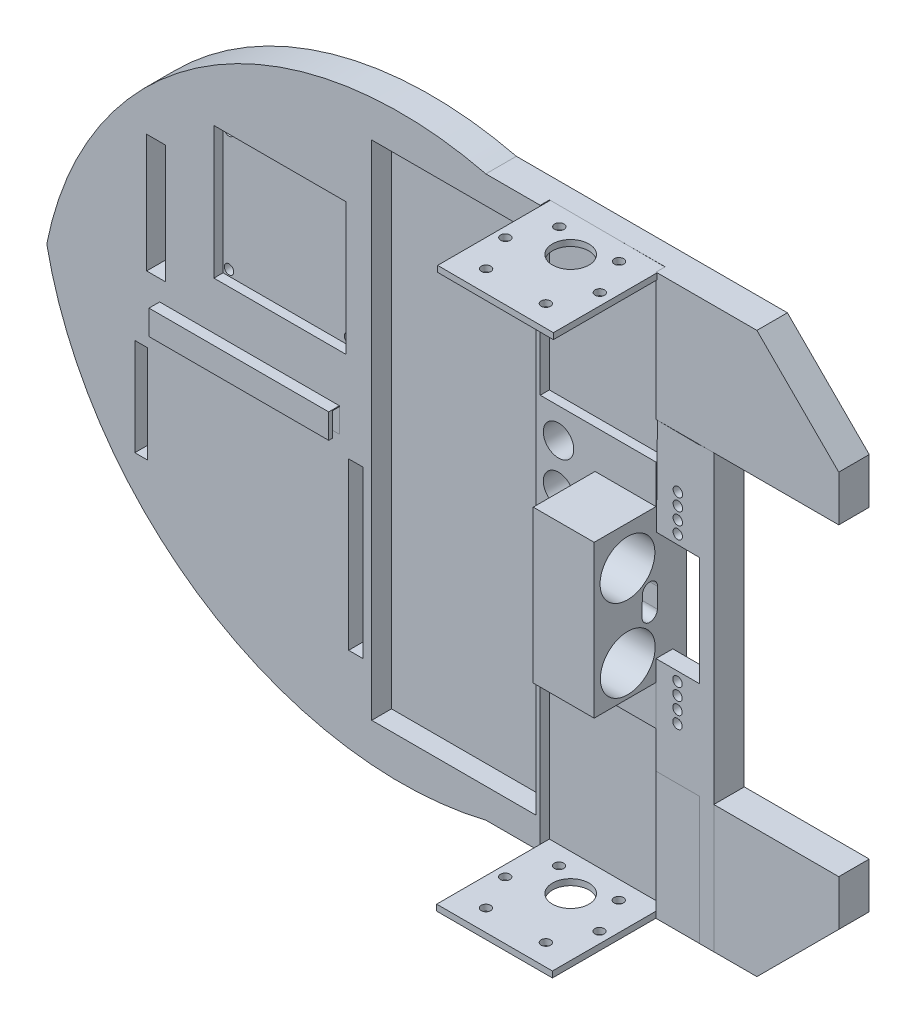
from build123d import *

# Parameters (mm, degrees)
BOSS_EXTRUDE1_DEPTH      = 10
BOSS_EXTRUDE1_DEPTH_BACK = 0.01
SKETCH3_W                = 38
SKETCH3_H                = 54
CUT_EXTRUDE1_DEPTH       = 3
SKETCH5_W                = 38
SKETCH5_H                = 54
CUT_EXTRUDE3_DEPTH       = 3
SKETCH7_W                = 54
SKETCH7_H                = 165
CUT_EXTRUDE4_DEPTH       = 6.5
SKETCH15_W               = 20
SKETCH15_H               = 50
BOSS_EXTRUDE3_DEPTH      = 20.3
SKETCH18_W               = 43.4
SKETCH18_H               = 43.4
CUT_EXTRUDE18_DEPTH      = 3
SKETCH21_R               = 9
CUT_EXTRUDE21_DEPTH      = 20
SKETCH22_R               = 1.55
CUT_EXTRUDE23_DEPTH      = 223.739666272
SKETCH25_W               = 59
SKETCH25_H               = 8.1
BOSS_EXTRUDE5_DEPTH      = 3.5
SKETCH28_W               = 4.75290021
SKETCH28_H               = 9.947843747
BOSS_EXTRUDE6_DEPTH      = 141.870057685
SKETCH36_W               = 38
SKETCH36_H               = 2
BOSS_EXTRUDE7_DEPTH      = 37
SKETCH39_R               = 6
SKETCH39_R_2             = 1.55
CUT_EXTRUDE28_DEPTH      = 2
SKETCH42_R               = 6
SKETCH42_R_2             = 1.55
CUT_EXTRUDE29_DEPTH      = 2
SKETCH44_W               = 2.25
SKETCH44_H               = 7.82
CUT_EXTRUDE30_DEPTH      = 59
BOSS_EXTRUDE8_REACH      = 227.847
SKETCH45_W               = 16.5
SKETCH45_H               = 32
SKETCH30_W               = 14.12
SKETCH30_H               = 25
CUT_EXTRUDE25_DEPTH      = 4.5
SKETCH33_R               = 1.55
CUT_EXTRUDE26_DEPTH      = 10.017641697
SKETCH46_R               = 5
CUT_EXTRUDE31_DEPTH      = 225.11173314
SKETCH47_W               = 6.139074003
SKETCH47_H               = 38.880802014
SKETCH47_W_2             = 4.706623401
SKETCH47_H_2             = 54.433122819
SKETCH47_W_3             = 4.092716002
SKETCH47_H_3             = 31.923184811
CUT_EXTRUDE32_DEPTH      = 225.11173314


with BuildPart() as part:
    # Sketch1 → Boss-Extrude1 (new, two sides: drawn at the far end of the back side and taken through both)
    with BuildSketch(Plane.XY.offset(-BOSS_EXTRUDE1_DEPTH_BACK)):
        with BuildLine():
            Line((0, 0), (0, -50))
            Line((0, -50), (60, -50))
            Line((60, -50), (60, -65))
            Line((60, -65), (33.129942315, -91.870057685))
            Line((33.129942315, -91.870057685), (-55.850057685, -91.870057685))
            ThreePointArc((-55.850057685, -91.870057685), (-147.4724214, -76.71648961), (-199.999956277, -0.132246858))
            ThreePointArc((-199.999956277, -0.132246858), (-147.567879237, 76.64550452), (-55.850057685, 91.870057685))
            Line((-55.850057685, 91.870057685), (33.129942315, 91.870057685))
            Line((33.129942315, 91.870057685), (60, 65))
            Line((60, 65), (60, 50))
            Line((60, 50), (0, 50))
            Line((0, 50), (0, 0))
        make_face()
    extrude(amount=BOSS_EXTRUDE1_DEPTH + BOSS_EXTRUDE1_DEPTH_BACK)

    # Sketch3 → Cut-Extrude1 (cut)
    with BuildSketch(Plane.XY.offset(10)):
        with Locations((-19, 64.870057685)):
            Rectangle(SKETCH3_W, SKETCH3_H)
    extrude(amount=-CUT_EXTRUDE1_DEPTH, mode=Mode.SUBTRACT)

    # Sketch5 → Cut-Extrude3 (cut)
    with BuildSketch(Plane.XY.offset(10)):
        with Locations((-19, -64.870057685)):
            Rectangle(SKETCH5_W, SKETCH5_H)
    extrude(amount=-CUT_EXTRUDE3_DEPTH, mode=Mode.SUBTRACT)

    # Sketch7 → Cut-Extrude4 (cut)
    with BuildSketch(Plane.XY.offset(10)):
        with Locations((-66.32515636, 0.28573122)):
            Rectangle(SKETCH7_W, SKETCH7_H)
    extrude(amount=-CUT_EXTRUDE4_DEPTH, mode=Mode.SUBTRACT)

    # Sketch15 → Boss-Extrude3 (add)
    with BuildSketch(Plane.XY.offset(10)):
        with Locations((-10, 0.20156489)):
            Rectangle(SKETCH15_W, SKETCH15_H)
    extrude(amount=BOSS_EXTRUDE3_DEPTH)

    # Sketch18 → Cut-Extrude18 (cut)
    with BuildSketch(Plane.XY.offset(10)):
        with Locations((-123.42454895, 39.3)):
            Rectangle(SKETCH18_W, SKETCH18_H)
    extrude(amount=-CUT_EXTRUDE18_DEPTH, mode=Mode.SUBTRACT)

    # Sketch21 → Cut-Extrude21 (cut)
    with BuildSketch(Plane(origin=(0, 0, 0), x_dir=(0, 0, -1), z_dir=(1, 0, 0))):
        with Locations((-19.36187505, 12.37175029)):
            Circle(SKETCH21_R)
        with Locations((-19.26539558, -14.62824971)):
            Circle(SKETCH21_R)
        with BuildLine():
            Line((-9.491579533, 2.276446619), (-9.557448357, -4.178698144))
            ThreePointArc((-9.557448357, -4.178698144), (-12.081396215, -6.651657156), (-14.554355227, -4.127709299))
            Line((-14.554355227, -4.127709299), (-14.488486403, 2.327435464))
            ThreePointArc((-14.488486403, 2.327435464), (-11.964538545, 4.800394476), (-9.491579533, 2.276446619))
        make_face()
    extrude(amount=-CUT_EXTRUDE21_DEPTH, mode=Mode.SUBTRACT)

    # Sketch22 → Cut-Extrude23 (cut, through all)
    with BuildSketch(Plane.XY.offset(7)):
        with Locations((-143.16862044, 58.97947337)):
            Circle(SKETCH22_R)
        with Locations((-103.76862044, 58.97947337)):
            Circle(SKETCH22_R)
        with Locations((-103.76862044, 19.57947337)):
            Circle(SKETCH22_R)
        with Locations((-143.16862044, 19.57947337)):
            Circle(SKETCH22_R)
    extrude(amount=-CUT_EXTRUDE23_DEPTH, mode=Mode.SUBTRACT)

    # Sketch25 → Boss-Extrude5 (add)
    with BuildSketch(Plane.XY.offset(10)):
        with Locations((-133.432578579, -2.134090808)):
            Rectangle(SKETCH25_W, SKETCH25_H)
    extrude(amount=BOSS_EXTRUDE5_DEPTH)

    # Sketch28 → Boss-Extrude6 (add)
    with BuildSketch(Plane.XZ.offset(91.870057685)):
        with Locations((16.603067585, 5.033719824)):
            Rectangle(SKETCH28_W, SKETCH28_H)
    extrude(amount=-BOSS_EXTRUDE6_DEPTH)

    # Sketch36 → Boss-Extrude7 (add)
    with BuildSketch(Plane.XY.offset(7)):
        Polygon((0.325623195, 91.814547745), (0.318530176, 89.814560323), (-37.681230846, 89.949327676), (-37.674137828, 91.949315098), align=None)
        with Locations((-19, -90.81512516)):
            Rectangle(SKETCH36_W, SKETCH36_H)
    extrude(amount=BOSS_EXTRUDE7_DEPTH)

    # Sketch39 → Cut-Extrude28 (cut)
    with BuildSketch(Plane.XZ.offset(91.81512516)):
        with Locations(Location((-19, 19, 0), (0, 0, 270))):
            Circle(SKETCH39_R)
        with Locations(Location((-34.499611559, 25.01055106, 0), (0, 0, 270))):
            Circle(SKETCH39_R_2)
        with Locations(Location((-3.563871147, 24.988758691, 0), (0, 0, 270))):
            Circle(SKETCH39_R_2)
        with Locations(Location((-28.819186805, 37.01055106, 0), (0, 0, 270))):
            Circle(SKETCH39_R_2)
        with Locations(Location((-9.177448314, 36.988758691, 0), (0, 0, 270))):
            Circle(SKETCH39_R_2)
        with Locations(Location((-28.819994175, 13.01055106, 0), (0, 0, 270))):
            Circle(SKETCH39_R_2)
        with Locations(Location((-9.230494356, 12.988758691, 0), (0, 0, 270))):
            Circle(SKETCH39_R_2)
    extrude(amount=-CUT_EXTRUDE28_DEPTH, mode=Mode.SUBTRACT)

    # Sketch42 → Cut-Extrude29 (cut)
    with BuildSketch(Plane(origin=(0.325623195, 91.814547745, 0), x_dir=(0.9999937111161443, -0.003546509292438372, 0), z_dir=(0.003546509292438372, 0.9999937111161443, 0))):
        with Locations(Location((-19.325818013, -19, 0), (0, 0, 180))):
            Circle(SKETCH42_R)
        with Locations(Location((-29.070149337, -13, 0), (0, 0, 180))):
            Circle(SKETCH42_R_2)
        with Locations(Location((-3.778432466, -25, 0), (0, 0, 180))):
            Circle(SKETCH42_R_2)
        with Locations(Location((-9.464104196, -13, 0), (0, 0, 180))):
            Circle(SKETCH42_R_2)
        with Locations(Location((-34.772326096, -25, 0), (0, 0, 180))):
            Circle(SKETCH42_R_2)
        with Locations(Location((-29.096493177, -37, 0), (0, 0, 180))):
            Circle(SKETCH42_R_2)
        with Locations(Location((-9.473371075, -37, 0), (0, 0, 180))):
            Circle(SKETCH42_R_2)
    extrude(amount=-CUT_EXTRUDE29_DEPTH, mode=Mode.SUBTRACT)

    # Sketch44 → Cut-Extrude30 (cut)
    with BuildSketch(Plane.ZY.offset(162.932578579)):
        with Locations((11.13716849, -2.28119145)):
            Rectangle(SKETCH44_W, SKETCH44_H)
    extrude(amount=-CUT_EXTRUDE30_DEPTH, mode=Mode.SUBTRACT)

    # Boss-Extrude8: up to this face of the body (flat: up to its plane)
    boss_extrude8_end = Plane(part.part.faces().sort_by_distance((16.603067585, -20.935028843, 10.007641697))[0])
    # Sketch45 → Boss-Extrude8 (add, up to the picked face)
    with BuildSketch(Plane(origin=(0, 0, -0.01), x_dir=(-1, 0, 0), z_dir=(0, 0, -1)), mode=Mode.PRIVATE) as boss_extrude8_sk1:
        Polygon((-0.170650113, 17.999191052), (-0.474028092, 49.997752923), (-16.973286556, 49.841323653), (-16.669908578, 17.842761782), align=None)
    boss_extrude8_tool1 = split(extrude(boss_extrude8_sk1.sketch, amount=-BOSS_EXTRUDE8_REACH, mode=Mode.PRIVATE), bisect_by=boss_extrude8_end, keep=Keep.BOTH, mode=Mode.PRIVATE)
    # Sketch45 → Boss-Extrude8 (add, up to the picked face)
    with BuildSketch(Plane(origin=(0, 0, -0.01), x_dir=(-1, 0, 0), z_dir=(0, 0, -1)), mode=Mode.PRIVATE) as boss_extrude8_sk2:
        with Locations((-8.25, -34)):
            Rectangle(SKETCH45_W, SKETCH45_H)
    boss_extrude8_tool2 = split(extrude(boss_extrude8_sk2.sketch, amount=-BOSS_EXTRUDE8_REACH, mode=Mode.PRIVATE), bisect_by=boss_extrude8_end, keep=Keep.BOTH, mode=Mode.PRIVATE)
    add(boss_extrude8_tool1.solids().sort_by(Axis((8.571968, 33.920257, -0.01), (0, 0, 1)))[0])
    add(boss_extrude8_tool2.solids().sort_by(Axis((8.25, -34, -0.01), (0, 0, 1)))[0])

    # Sketch30 → Cut-Extrude25 (cut)
    with BuildSketch(Plane(origin=(0, 0, -0.01), x_dir=(-1, 0, 0), z_dir=(0, 0, -1))):
        with Locations((-7.06, -28.51)):
            Rectangle(SKETCH30_W, SKETCH30_H)
        Polygon((-14.292411252, 40.945582253), (-14.187225928, 15.945803533), (-0.067350907, 16.005212204), (-0.172536231, 41.004990924), align=None)
    extrude(amount=-CUT_EXTRUDE25_DEPTH, mode=Mode.SUBTRACT)

    # Sketch33 → Cut-Extrude26 (cut)
    with BuildSketch(Plane(origin=(0, 0, -0.01), x_dir=(-1, 0, 0), z_dir=(0, 0, -1))):
        with Locations((-7.06, -33)):
            Circle(SKETCH33_R)
        with Locations((-7.06, -29)):
            Circle(SKETCH33_R)
        with Locations((-7.06, -25)):
            Circle(SKETCH33_R)
        with Locations((-7.06, -21)):
            Circle(SKETCH33_R)
        with Locations((-7.145509491, 20.971058488)):
            Circle(SKETCH33_R)
        with Locations((-7.161808177, 24.971025282)):
            Circle(SKETCH33_R)
        with Locations((-7.178106862, 28.970992076)):
            Circle(SKETCH33_R)
        with Locations((-7.194405548, 32.97095887)):
            Circle(SKETCH33_R)
    extrude(amount=-CUT_EXTRUDE26_DEPTH, mode=Mode.SUBTRACT)

    # Sketch46 → Cut-Extrude31 (cut, through all)
    with BuildSketch(Plane.XY.offset(10)):
        with Locations((-32, 28)):
            Circle(SKETCH46_R)
        with Locations((-32, 14)):
            Circle(SKETCH46_R)
        with Locations((-32, 0)):
            Circle(SKETCH46_R)
        with Locations((-32, -14)):
            Circle(SKETCH46_R)
        with Locations((-32, -28)):
            Circle(SKETCH46_R)
    extrude(amount=-CUT_EXTRUDE31_DEPTH, mode=Mode.SUBTRACT)

    # Sketch47 → Cut-Extrude32 (cut, through all)
    with BuildSketch(Plane.XY.offset(10)):
        with Locations((-164.132446172, 28.036052806)):
            Rectangle(SKETCH47_W, SKETCH47_H)
        with Locations((-98.546672249, -38.879853818)):
            Rectangle(SKETCH47_W_2, SKETCH47_H_2)
        with Locations((-169.043705373, -29.057335414)):
            Rectangle(SKETCH47_W_3, SKETCH47_H_3)
    extrude(amount=-CUT_EXTRUDE32_DEPTH, mode=Mode.SUBTRACT)


solid = part.part
